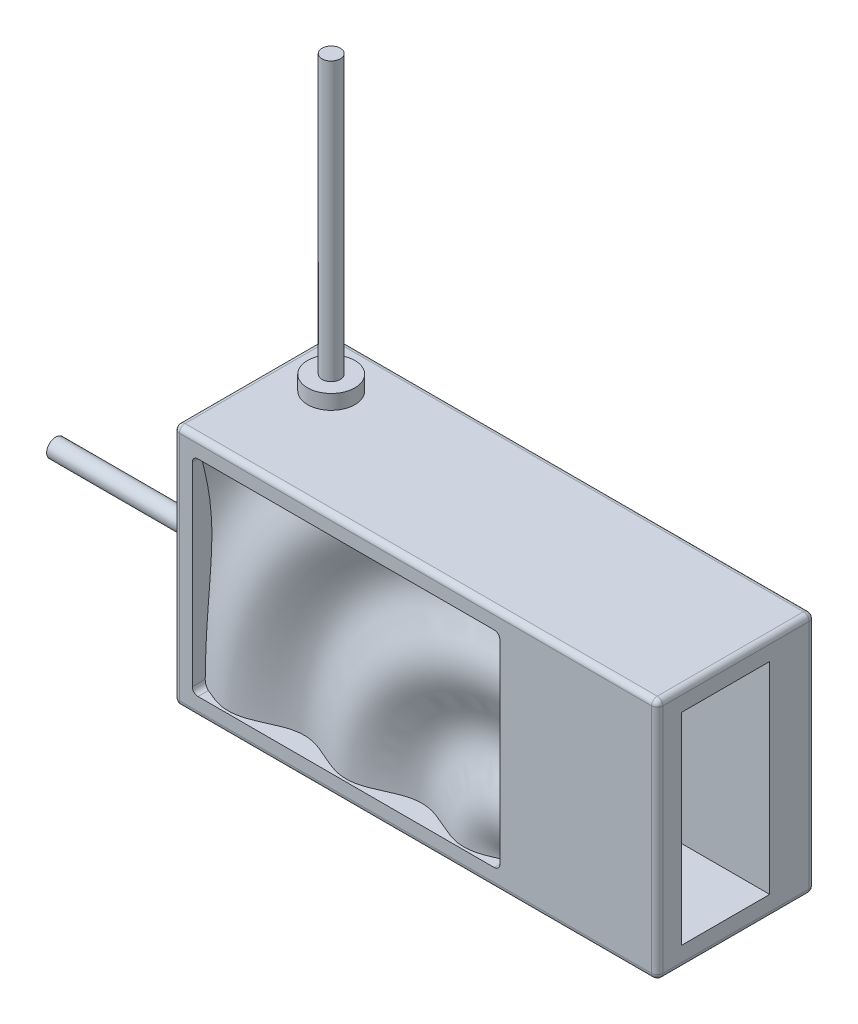
from build123d import *

# Parameters (mm, degrees)
SKETCH1_W           = 43
SKETCH1_H           = 21.6
BOSS_EXTRUDE1_DEPTH = 14
SKETCH2_W           = 27.35
SKETCH2_H           = 18.3
CUT_EXTRUDE1_DEPTH  = 2
SKETCH3_W           = 7.85
SKETCH3_H           = 17.94
CUT_EXTRUDE2_DEPTH  = 8
REVOLVE2_ANGLE      = 90
SKETCH5_W           = 92.23581066
SKETCH5_H           = 73.43389541
SKETCH5_W_2         = 43
SKETCH5_H_2         = 21.6
CUT_EXTRUDE3_DEPTH  = 23
SKETCH6_R           = 2.105
SKETCH6_R_2         = 0.81
BOSS_EXTRUDE2_DEPTH = 1.3
SKETCH7_R           = 2.105
SKETCH7_R_2         = 0.81
BOSS_EXTRUDE3_DEPTH = 1.3
SKETCH8_R           = 0.81
BOSS_EXTRUDE4_DEPTH = 20
SKETCH9_R           = 0.815150105
BOSS_EXTRUDE5_DEPTH = 26
FILLET1_R           = 0.5


with BuildPart() as part:
    # Sketch1 → Boss-Extrude1 (new body)
    with BuildSketch(Plane.XY):
        Rectangle(SKETCH1_W, SKETCH1_H)
    extrude(amount=BOSS_EXTRUDE1_DEPTH)

    # Sketch2 → Cut-Extrude1 (cut)
    with BuildSketch(Plane.XY.offset(14)):
        with Locations((-6.175, 0)):
            Rectangle(SKETCH2_W, SKETCH2_H)
    extrude(amount=-CUT_EXTRUDE1_DEPTH, mode=Mode.SUBTRACT)

    # Sketch3 → Cut-Extrude2 (cut)
    with BuildSketch(Plane(origin=(21.5, 0, 0), x_dir=(0, 0, -1), z_dir=(1, 0, 0))):
        with Locations((-7.925, 0)):
            Rectangle(SKETCH3_W, SKETCH3_H)
    extrude(amount=-CUT_EXTRUDE2_DEPTH, mode=Mode.SUBTRACT)

    # Sketch4 → Revolve2 (revolve)
    with BuildSketch(Plane(origin=(0, -9.15, 0), x_dir=(1, 0, 0), z_dir=(0, 1, 0))):
        with BuildLine():
            Line((-32.583466089, -10.1469511), (-32.583466089, -12.265551486))
            add(Edge.make_bspline(
                [(-32.583466089, -12.265551486), (-32.562502483, -12.265551486), (-32.520421916, -12.266006033), (-32.4432028, -12.268051491), (-32.333162226, -12.273488053), (-32.204458453, -12.283626191), (-32.058326628, -12.301036433), (-31.883418572, -12.328702131), (-31.686720457, -12.369661846), (-31.491837838, -12.419079982), (-31.298991654, -12.47598715), (-31.074449095, -12.55061405), (-30.819301893, -12.645650497), (-30.534581384, -12.762541391), (-30.220087155, -12.900547222), (-29.829076239, -13.077316326), (-29.358834293, -13.28780702), (-28.785809577, -13.519520804), (-28.090562481, -13.719040931), (-27.293796046, -13.805648084), (-26.419142059, -13.693362453), (-25.49136496, -13.369953032), (-24.502198634, -12.908600866), (-23.392162802, -12.415282136), (-22.124309457, -12.154525407), (-20.858041285, -12.40646563), (-19.751906697, -12.893751072), (-18.769192416, -13.353235169), (-17.846551628, -13.682182536), (-16.973609278, -13.804616553), (-16.009305612, -13.711847073), (-15.005547104, -13.37431948), (-14.04749388, -12.909101), (-13.049418653, -12.482723934), (-12.133440252, -12.262513677), (-11.3353156, -12.242983824), (-10.409800826, -12.421010141), (-9.400945989, -12.826034613), (-8.434871057, -13.30301482), (-7.417140082, -13.675236005), (-6.457099181, -13.803910561), (-5.606473079, -13.72128943), (-4.682813704, -13.427765218), (-3.69904901, -12.975867192), (-2.756532087, -12.543833591), (-1.795314434, -12.273179903), (-0.966070624, -12.243102783), (-0.315946216, -12.343671298), (0.265672195, -12.515998278), (0.783591987, -12.717624267), (1.405691454, -12.993439328), (2.136134729, -13.329294572), (2.847403799, -13.604786677), (3.551966265, -13.750324658), (4.099646321, -13.773217429), (4.475706664, -13.751363619), (4.917058627, -13.680358163), (5.404652636, -13.54933903), (5.879870794, -13.370834982), (6.304903895, -13.187020764), (6.697517429, -13.011274996), (6.938033599, -12.90064266), (7.234652875, -12.773222965), (7.35452597, -12.722686103), (7.41653391, -12.697417231)],
                knots=[0.083339346, 0.083339346, 0.083339346, 0.083339346, 0.083339346, 0.085336612, 0.087333879, 0.089331145, 0.091328411, 0.095322944, 0.099317476, 0.103312008, 0.107306541, 0.111301073, 0.115295606, 0.122119207, 0.128942808, 0.13576641, 0.142590011, 0.156237213, 0.169884416, 0.18488454, 0.199884664, 0.219547445, 0.239210226, 0.26281996, 0.286429695, 0.316430056, 0.339777495, 0.363124933, 0.382799659, 0.402474385, 0.417474496, 0.432474606, 0.459256287, 0.486037969, 0.502278436, 0.518518903, 0.53373395, 0.548948997, 0.576756025, 0.604563053, 0.61956323, 0.634563408, 0.65321264, 0.671861872, 0.696234785, 0.720607698, 0.735607914, 0.750608131, 0.761649817, 0.772691503, 0.783733188, 0.794774874, 0.815713505, 0.836652137, 0.844152286, 0.851652435, 0.859152585, 0.866652734, 0.879411498, 0.892170261, 0.898549642, 0.904929024, 0.911308406, 0.917687787, 0.917687787, 0.917687787, 0.917687787, 0.917687787], degree=4))
            Line((7.41653391, -12.697417231), (7.41653391, -10.1469511))
            Line((7.41653391, -10.1469511), (-32.583466089, -10.1469511))
        make_face()
    revolve(axis=Axis((7.5, -9.15, 12), (0, 0, -1)), revolution_arc=REVOLVE2_ANGLE)

    # Sketch5 → Cut-Extrude3 (cut)
    with BuildSketch(Plane.XY):
        with Locations((3.214998373, 5.833103881)):
            Rectangle(SKETCH5_W, SKETCH5_H)
        Rectangle(SKETCH5_W_2, SKETCH5_H_2, mode=Mode.SUBTRACT)
    extrude(amount=CUT_EXTRUDE3_DEPTH, mode=Mode.SUBTRACT)

    # Sketch6 → Boss-Extrude2 (add)
    with BuildSketch(Plane.ZY.offset(21.5)):
        with Locations(Location((4.5, -5.8, 0), (0, 0, 180))):
            Circle(SKETCH6_R)
        with Locations((4.5, -5.8)):
            Circle(SKETCH6_R_2, mode=Mode.SUBTRACT)
    extrude(amount=BOSS_EXTRUDE2_DEPTH)

    # Sketch7 → Boss-Extrude3 (add)
    with BuildSketch(Plane(origin=(0, 10.8, -10.8), x_dir=(1, 0, 0), z_dir=(0, -1, 0))):
        with Locations(Location((-17, 15.3, 0), (0, 0, 270))):
            Circle(SKETCH7_R)
        with Locations(Location((-17, 15.3, 0), (0, 0, 270))):
            Circle(SKETCH7_R_2, mode=Mode.SUBTRACT)
    extrude(amount=-BOSS_EXTRUDE3_DEPTH)

    # Sketch8 → Boss-Extrude4 (add)
    with BuildSketch(Plane.ZY.offset(21.5)):
        with Locations((4.5, -5.8)):
            Circle(SKETCH8_R)
    extrude(amount=BOSS_EXTRUDE4_DEPTH)

    # Sketch9 → Boss-Extrude5 (add)
    with BuildSketch(Plane(origin=(0, 10.8, 0), x_dir=(1, 0, 0), z_dir=(0, 1, 0))):
        with Locations(Location((-17, -4.5, 0), (0, 0, 90))):
            Circle(SKETCH9_R)
    extrude(amount=BOSS_EXTRUDE5_DEPTH)

    # Fillet1
    fillet1_edges = [part.edges().sort_by_distance(p)[0] for p in [
        (-21.5, -10.8, 7),
        (0, -10.8, 14),
        (21.5, -10.8, 7),
        (0, 10.8, 0),
        (-21.5, 0, 0),
        (0, -10.8, 0),
        (21.5, 0, 0),
        (7.5, -9.15, 13),
        (7.5, 9.15, 13.179370152),
        (-19.85, 9.15, 13.656100765),
        (-19.85, -9.15, 13.428261731),
        (-21.5, 0, 14),
        (-21.5, 10.8, 7),
        (0, 10.8, 14),
        (21.5, 10.8, 7),
        (21.5, 0, 14),
    ]]
    fillet(fillet1_edges, radius=FILLET1_R)


solid = part.part
